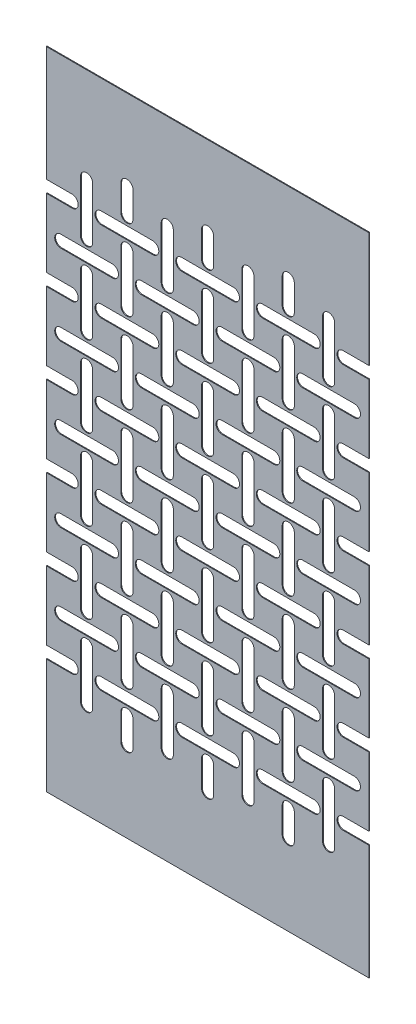
from build123d import *

# Parameters (mm, degrees)
BOSS_EXTRUDE1_DEPTH = 0.2


with BuildPart() as part:
    # Model → Boss-Extrude1 (new body)
    with BuildSketch(Plane.XY):
        with BuildLine():
            Line((0, 31.5), (6.4031, 31.5))
            ThreePointArc((6.4031, 31.5), (7.9031, 30), (6.4031, 28.5))
            Line((6.4031, 28.5), (0, 28.5))
            Line((0, 28.5), (0, 0))
            Line((0, 0), (80, 0))
            Line((80, 0), (80, 28.5))
            Line((80, 28.5), (73.5969, 28.5))
            ThreePointArc((73.5969, 28.5), (72.0969, 30), (73.5969, 31.5))
            Line((73.5969, 31.5), (80, 31.5))
            Line((80, 31.5), (80, 48.5))
            Line((80, 48.5), (73.5969, 48.5))
            ThreePointArc((73.5969, 48.5), (72.0969, 50), (73.5969, 51.5))
            Line((73.5969, 51.5), (80, 51.5))
            Line((80, 51.5), (80, 68.5))
            Line((80, 68.5), (73.5969, 68.5))
            ThreePointArc((73.5969, 68.5), (72.0969, 70), (73.5969, 71.5))
            Line((73.5969, 71.5), (80, 71.5))
            Line((80, 71.5), (80, 88.5))
            Line((80, 88.5), (73.5969, 88.5))
            ThreePointArc((73.5969, 88.5), (72.0969, 90), (73.5969, 91.5))
            Line((73.5969, 91.5), (80, 91.5))
            Line((80, 91.5), (80, 108.5))
            Line((80, 108.5), (73.5969, 108.5))
            ThreePointArc((73.5969, 108.5), (72.0969, 110), (73.5969, 111.5))
            Line((73.5969, 111.5), (80, 111.5))
            Line((80, 111.5), (80, 128.5))
            Line((80, 128.5), (73.5969, 128.5))
            ThreePointArc((73.5969, 128.5), (72.0969, 130), (73.5969, 131.5))
            Line((73.5969, 131.5), (80, 131.5))
            Line((80, 131.5), (80, 160))
            Line((80, 160), (0, 160))
            Line((0, 160), (0, 131.5))
            Line((0, 131.5), (6.4031, 131.5))
            ThreePointArc((6.4031, 131.5), (7.9031, 130), (6.4031, 128.5))
            Line((6.4031, 128.5), (0, 128.5))
            Line((0, 128.5), (0, 111.5))
            Line((0, 111.5), (6.4031, 111.5))
            ThreePointArc((6.4031, 111.5), (7.9031, 110), (6.4031, 108.5))
            Line((6.4031, 108.5), (0, 108.5))
            Line((0, 108.5), (0, 91.5))
            Line((0, 91.5), (6.4031, 91.5))
            ThreePointArc((6.4031, 91.5), (7.9031, 90), (6.4031, 88.5))
            Line((6.4031, 88.5), (0, 88.5))
            Line((0, 88.5), (0, 71.5))
            Line((0, 71.5), (6.4031, 71.5))
            ThreePointArc((6.4031, 71.5), (7.9031, 70), (6.4031, 68.5))
            Line((6.4031, 68.5), (0, 68.5))
            Line((0, 68.5), (0, 51.5))
            Line((0, 51.5), (6.4031, 51.5))
            ThreePointArc((6.4031, 51.5), (7.9031, 50), (6.4031, 48.5))
            Line((6.4031, 48.5), (0, 48.5))
            Line((0, 48.5), (0, 31.5))
        make_face()
        with BuildLine():
            Line((13.5969, 31.5), (26.4031, 31.5))
            ThreePointArc((26.4031, 31.5), (27.9031, 30), (26.4031, 28.5))
            Line((26.4031, 28.5), (13.5969, 28.5))
            ThreePointArc((13.5969, 28.5), (12.0969, 30), (13.5969, 31.5))
        make_face(mode=Mode.SUBTRACT)
        with BuildLine():
            Line((33.5969, 31.5), (46.4031, 31.5))
            ThreePointArc((46.4031, 31.5), (47.9031, 30), (46.4031, 28.5))
            Line((46.4031, 28.5), (33.5969, 28.5))
            ThreePointArc((33.5969, 28.5), (32.0969, 30), (33.5969, 31.5))
        make_face(mode=Mode.SUBTRACT)
        with BuildLine():
            Line((53.5969, 31.5), (66.4031, 31.5))
            ThreePointArc((66.4031, 31.5), (67.9031, 30), (66.4031, 28.5))
            Line((66.4031, 28.5), (53.5969, 28.5))
            ThreePointArc((53.5969, 28.5), (52.0969, 30), (53.5969, 31.5))
        make_face(mode=Mode.SUBTRACT)
        with BuildLine():
            Line((3.5969, 41.5), (16.4031, 41.5))
            ThreePointArc((16.4031, 41.5), (17.9031, 40), (16.4031, 38.5))
            Line((16.4031, 38.5), (3.5969, 38.5))
            ThreePointArc((3.5969, 38.5), (2.0969, 40), (3.5969, 41.5))
        make_face(mode=Mode.SUBTRACT)
        with BuildLine():
            Line((23.5969, 41.5), (36.4031, 41.5))
            ThreePointArc((36.4031, 41.5), (37.9031, 40), (36.4031, 38.5))
            Line((36.4031, 38.5), (23.5969, 38.5))
            ThreePointArc((23.5969, 38.5), (22.0969, 40), (23.5969, 41.5))
        make_face(mode=Mode.SUBTRACT)
        with BuildLine():
            Line((43.5969, 41.5), (56.4031, 41.5))
            ThreePointArc((56.4031, 41.5), (57.9031, 40), (56.4031, 38.5))
            Line((56.4031, 38.5), (43.5969, 38.5))
            ThreePointArc((43.5969, 38.5), (42.0969, 40), (43.5969, 41.5))
        make_face(mode=Mode.SUBTRACT)
        with BuildLine():
            Line((63.5969, 41.5), (76.4031, 41.5))
            ThreePointArc((76.4031, 41.5), (77.9031, 40), (76.4031, 38.5))
            Line((76.4031, 38.5), (63.5969, 38.5))
            ThreePointArc((63.5969, 38.5), (62.0969, 40), (63.5969, 41.5))
        make_face(mode=Mode.SUBTRACT)
        with BuildLine():
            Line((13.5969, 51.5), (26.4031, 51.5))
            ThreePointArc((26.4031, 51.5), (27.9031, 50), (26.4031, 48.5))
            Line((26.4031, 48.5), (13.5969, 48.5))
            ThreePointArc((13.5969, 48.5), (12.0969, 50), (13.5969, 51.5))
        make_face(mode=Mode.SUBTRACT)
        with BuildLine():
            Line((33.5969, 51.5), (46.4031, 51.5))
            ThreePointArc((46.4031, 51.5), (47.9031, 50), (46.4031, 48.5))
            Line((46.4031, 48.5), (33.5969, 48.5))
            ThreePointArc((33.5969, 48.5), (32.0969, 50), (33.5969, 51.5))
        make_face(mode=Mode.SUBTRACT)
        with BuildLine():
            Line((53.5969, 51.5), (66.4031, 51.5))
            ThreePointArc((66.4031, 51.5), (67.9031, 50), (66.4031, 48.5))
            Line((66.4031, 48.5), (53.5969, 48.5))
            ThreePointArc((53.5969, 48.5), (52.0969, 50), (53.5969, 51.5))
        make_face(mode=Mode.SUBTRACT)
        with BuildLine():
            Line((3.5969, 61.5), (16.4031, 61.5))
            ThreePointArc((16.4031, 61.5), (17.9031, 60), (16.4031, 58.5))
            Line((16.4031, 58.5), (3.5969, 58.5))
            ThreePointArc((3.5969, 58.5), (2.0969, 60), (3.5969, 61.5))
        make_face(mode=Mode.SUBTRACT)
        with BuildLine():
            Line((23.5969, 61.5), (36.4031, 61.5))
            ThreePointArc((36.4031, 61.5), (37.9031, 60), (36.4031, 58.5))
            Line((36.4031, 58.5), (23.5969, 58.5))
            ThreePointArc((23.5969, 58.5), (22.0969, 60), (23.5969, 61.5))
        make_face(mode=Mode.SUBTRACT)
        with BuildLine():
            Line((43.5969, 61.5), (56.4031, 61.5))
            ThreePointArc((56.4031, 61.5), (57.9031, 60), (56.4031, 58.5))
            Line((56.4031, 58.5), (43.5969, 58.5))
            ThreePointArc((43.5969, 58.5), (42.0969, 60), (43.5969, 61.5))
        make_face(mode=Mode.SUBTRACT)
        with BuildLine():
            Line((63.5969, 61.5), (76.4031, 61.5))
            ThreePointArc((76.4031, 61.5), (77.9031, 60), (76.4031, 58.5))
            Line((76.4031, 58.5), (63.5969, 58.5))
            ThreePointArc((63.5969, 58.5), (62.0969, 60), (63.5969, 61.5))
        make_face(mode=Mode.SUBTRACT)
        with BuildLine():
            Line((13.5969, 71.5), (26.4031, 71.5))
            ThreePointArc((26.4031, 71.5), (27.9031, 70), (26.4031, 68.5))
            Line((26.4031, 68.5), (13.5969, 68.5))
            ThreePointArc((13.5969, 68.5), (12.0969, 70), (13.5969, 71.5))
        make_face(mode=Mode.SUBTRACT)
        with BuildLine():
            Line((33.5969, 71.5), (46.4031, 71.5))
            ThreePointArc((46.4031, 71.5), (47.9031, 70), (46.4031, 68.5))
            Line((46.4031, 68.5), (33.5969, 68.5))
            ThreePointArc((33.5969, 68.5), (32.0969, 70), (33.5969, 71.5))
        make_face(mode=Mode.SUBTRACT)
        with BuildLine():
            Line((53.5969, 71.5), (66.4031, 71.5))
            ThreePointArc((66.4031, 71.5), (67.9031, 70), (66.4031, 68.5))
            Line((66.4031, 68.5), (53.5969, 68.5))
            ThreePointArc((53.5969, 68.5), (52.0969, 70), (53.5969, 71.5))
        make_face(mode=Mode.SUBTRACT)
        with BuildLine():
            Line((3.5969, 81.5), (16.4031, 81.5))
            ThreePointArc((16.4031, 81.5), (17.9031, 80), (16.4031, 78.5))
            Line((16.4031, 78.5), (3.5969, 78.5))
            ThreePointArc((3.5969, 78.5), (2.0969, 80), (3.5969, 81.5))
        make_face(mode=Mode.SUBTRACT)
        with BuildLine():
            Line((23.5969, 81.5), (36.4031, 81.5))
            ThreePointArc((36.4031, 81.5), (37.9031, 80), (36.4031, 78.5))
            Line((36.4031, 78.5), (23.5969, 78.5))
            ThreePointArc((23.5969, 78.5), (22.0969, 80), (23.5969, 81.5))
        make_face(mode=Mode.SUBTRACT)
        with BuildLine():
            Line((43.5969, 81.5), (56.4031, 81.5))
            ThreePointArc((56.4031, 81.5), (57.9031, 80), (56.4031, 78.5))
            Line((56.4031, 78.5), (43.5969, 78.5))
            ThreePointArc((43.5969, 78.5), (42.0969, 80), (43.5969, 81.5))
        make_face(mode=Mode.SUBTRACT)
        with BuildLine():
            Line((63.5969, 81.5), (76.4031, 81.5))
            ThreePointArc((76.4031, 81.5), (77.9031, 80), (76.4031, 78.5))
            Line((76.4031, 78.5), (63.5969, 78.5))
            ThreePointArc((63.5969, 78.5), (62.0969, 80), (63.5969, 81.5))
        make_face(mode=Mode.SUBTRACT)
        with BuildLine():
            Line((13.5969, 91.5), (26.4031, 91.5))
            ThreePointArc((26.4031, 91.5), (27.9031, 90), (26.4031, 88.5))
            Line((26.4031, 88.5), (13.5969, 88.5))
            ThreePointArc((13.5969, 88.5), (12.0969, 90), (13.5969, 91.5))
        make_face(mode=Mode.SUBTRACT)
        with BuildLine():
            Line((33.5969, 91.5), (46.4031, 91.5))
            ThreePointArc((46.4031, 91.5), (47.9031, 90), (46.4031, 88.5))
            Line((46.4031, 88.5), (33.5969, 88.5))
            ThreePointArc((33.5969, 88.5), (32.0969, 90), (33.5969, 91.5))
        make_face(mode=Mode.SUBTRACT)
        with BuildLine():
            Line((53.5969, 91.5), (66.4031, 91.5))
            ThreePointArc((66.4031, 91.5), (67.9031, 90), (66.4031, 88.5))
            Line((66.4031, 88.5), (53.5969, 88.5))
            ThreePointArc((53.5969, 88.5), (52.0969, 90), (53.5969, 91.5))
        make_face(mode=Mode.SUBTRACT)
        with BuildLine():
            Line((3.5969, 101.5), (16.4031, 101.5))
            ThreePointArc((16.4031, 101.5), (17.9031, 100), (16.4031, 98.5))
            Line((16.4031, 98.5), (3.5969, 98.5))
            ThreePointArc((3.5969, 98.5), (2.0969, 100), (3.5969, 101.5))
        make_face(mode=Mode.SUBTRACT)
        with BuildLine():
            Line((23.5969, 101.5), (36.4031, 101.5))
            ThreePointArc((36.4031, 101.5), (37.9031, 100), (36.4031, 98.5))
            Line((36.4031, 98.5), (23.5969, 98.5))
            ThreePointArc((23.5969, 98.5), (22.0969, 100), (23.5969, 101.5))
        make_face(mode=Mode.SUBTRACT)
        with BuildLine():
            Line((43.5969, 101.5), (56.4031, 101.5))
            ThreePointArc((56.4031, 101.5), (57.9031, 100), (56.4031, 98.5))
            Line((56.4031, 98.5), (43.5969, 98.5))
            ThreePointArc((43.5969, 98.5), (42.0969, 100), (43.5969, 101.5))
        make_face(mode=Mode.SUBTRACT)
        with BuildLine():
            Line((63.5969, 101.5), (76.4031, 101.5))
            ThreePointArc((76.4031, 101.5), (77.9031, 100), (76.4031, 98.5))
            Line((76.4031, 98.5), (63.5969, 98.5))
            ThreePointArc((63.5969, 98.5), (62.0969, 100), (63.5969, 101.5))
        make_face(mode=Mode.SUBTRACT)
        with BuildLine():
            Line((13.5969, 111.5), (26.4031, 111.5))
            ThreePointArc((26.4031, 111.5), (27.9031, 110), (26.4031, 108.5))
            Line((26.4031, 108.5), (13.5969, 108.5))
            ThreePointArc((13.5969, 108.5), (12.0969, 110), (13.5969, 111.5))
        make_face(mode=Mode.SUBTRACT)
        with BuildLine():
            Line((33.5969, 111.5), (46.4031, 111.5))
            ThreePointArc((46.4031, 111.5), (47.9031, 110), (46.4031, 108.5))
            Line((46.4031, 108.5), (33.5969, 108.5))
            ThreePointArc((33.5969, 108.5), (32.0969, 110), (33.5969, 111.5))
        make_face(mode=Mode.SUBTRACT)
        with BuildLine():
            Line((53.5969, 111.5), (66.4031, 111.5))
            ThreePointArc((66.4031, 111.5), (67.9031, 110), (66.4031, 108.5))
            Line((66.4031, 108.5), (53.5969, 108.5))
            ThreePointArc((53.5969, 108.5), (52.0969, 110), (53.5969, 111.5))
        make_face(mode=Mode.SUBTRACT)
        with BuildLine():
            Line((3.5969, 121.5), (16.4031, 121.5))
            ThreePointArc((16.4031, 121.5), (17.9031, 120), (16.4031, 118.5))
            Line((16.4031, 118.5), (3.5969, 118.5))
            ThreePointArc((3.5969, 118.5), (2.0969, 120), (3.5969, 121.5))
        make_face(mode=Mode.SUBTRACT)
        with BuildLine():
            Line((23.5969, 121.5), (36.4031, 121.5))
            ThreePointArc((36.4031, 121.5), (37.9031, 120), (36.4031, 118.5))
            Line((36.4031, 118.5), (23.5969, 118.5))
            ThreePointArc((23.5969, 118.5), (22.0969, 120), (23.5969, 121.5))
        make_face(mode=Mode.SUBTRACT)
        with BuildLine():
            Line((43.5969, 121.5), (56.4031, 121.5))
            ThreePointArc((56.4031, 121.5), (57.9031, 120), (56.4031, 118.5))
            Line((56.4031, 118.5), (43.5969, 118.5))
            ThreePointArc((43.5969, 118.5), (42.0969, 120), (43.5969, 121.5))
        make_face(mode=Mode.SUBTRACT)
        with BuildLine():
            Line((63.5969, 121.5), (76.4031, 121.5))
            ThreePointArc((76.4031, 121.5), (77.9031, 120), (76.4031, 118.5))
            Line((76.4031, 118.5), (63.5969, 118.5))
            ThreePointArc((63.5969, 118.5), (62.0969, 120), (63.5969, 121.5))
        make_face(mode=Mode.SUBTRACT)
        with BuildLine():
            Line((13.5969, 131.5), (26.4031, 131.5))
            ThreePointArc((26.4031, 131.5), (27.9031, 130), (26.4031, 128.5))
            Line((26.4031, 128.5), (13.5969, 128.5))
            ThreePointArc((13.5969, 128.5), (12.0969, 130), (13.5969, 131.5))
        make_face(mode=Mode.SUBTRACT)
        with BuildLine():
            Line((33.5969, 131.5), (46.4031, 131.5))
            ThreePointArc((46.4031, 131.5), (47.9031, 130), (46.4031, 128.5))
            Line((46.4031, 128.5), (33.5969, 128.5))
            ThreePointArc((33.5969, 128.5), (32.0969, 130), (33.5969, 131.5))
        make_face(mode=Mode.SUBTRACT)
        with BuildLine():
            Line((53.5969, 131.5), (66.4031, 131.5))
            ThreePointArc((66.4031, 131.5), (67.9031, 130), (66.4031, 128.5))
            Line((66.4031, 128.5), (53.5969, 128.5))
            ThreePointArc((53.5969, 128.5), (52.0969, 130), (53.5969, 131.5))
        make_face(mode=Mode.SUBTRACT)
        with BuildLine():
            Line((11.5, 23.5969), (11.5, 36.4031))
            ThreePointArc((11.5, 36.4031), (10, 37.9031), (8.5, 36.4031))
            Line((8.5, 36.4031), (8.5, 23.5969))
            ThreePointArc((8.5, 23.5969), (10, 22.0969), (11.5, 23.5969))
        make_face(mode=Mode.SUBTRACT)
        with BuildLine():
            Line((11.5, 43.5969), (11.5, 56.4031))
            ThreePointArc((11.5, 56.4031), (10, 57.9031), (8.5, 56.4031))
            Line((8.5, 56.4031), (8.5, 43.5969))
            ThreePointArc((8.5, 43.5969), (10, 42.0969), (11.5, 43.5969))
        make_face(mode=Mode.SUBTRACT)
        with BuildLine():
            Line((11.5, 63.5969), (11.5, 76.4031))
            ThreePointArc((11.5, 76.4031), (10, 77.9031), (8.5, 76.4031))
            Line((8.5, 76.4031), (8.5, 63.5969))
            ThreePointArc((8.5, 63.5969), (10, 62.0969), (11.5, 63.5969))
        make_face(mode=Mode.SUBTRACT)
        with BuildLine():
            Line((11.5, 83.5969), (11.5, 96.4031))
            ThreePointArc((11.5, 96.4031), (10, 97.9031), (8.5, 96.4031))
            Line((8.5, 96.4031), (8.5, 83.5969))
            ThreePointArc((8.5, 83.5969), (10, 82.0969), (11.5, 83.5969))
        make_face(mode=Mode.SUBTRACT)
        with BuildLine():
            Line((11.5, 103.5969), (11.5, 116.4031))
            ThreePointArc((11.5, 116.4031), (10, 117.9031), (8.5, 116.4031))
            Line((8.5, 116.4031), (8.5, 103.5969))
            ThreePointArc((8.5, 103.5969), (10, 102.0969), (11.5, 103.5969))
        make_face(mode=Mode.SUBTRACT)
        with BuildLine():
            Line((11.5, 123.5969), (11.5, 136.4031))
            ThreePointArc((11.5, 136.4031), (10, 137.9031), (8.5, 136.4031))
            Line((8.5, 136.4031), (8.5, 123.5969))
            ThreePointArc((8.5, 123.5969), (10, 122.0969), (11.5, 123.5969))
        make_face(mode=Mode.SUBTRACT)
        with BuildLine():
            Line((21.5, 20), (21.5, 26.4031))
            ThreePointArc((21.5, 26.4031), (20, 27.9031), (18.5, 26.4031))
            Line((18.5, 26.4031), (18.5, 20))
            ThreePointArc((18.5, 20), (20, 18.5), (21.5, 20))
        make_face(mode=Mode.SUBTRACT)
        with BuildLine():
            Line((21.5, 33.5969), (21.5, 46.4031))
            ThreePointArc((21.5, 46.4031), (20, 47.9031), (18.5, 46.4031))
            Line((18.5, 46.4031), (18.5, 33.5969))
            ThreePointArc((18.5, 33.5969), (20, 32.0969), (21.5, 33.5969))
        make_face(mode=Mode.SUBTRACT)
        with BuildLine():
            Line((21.5, 53.5969), (21.5, 66.4031))
            ThreePointArc((21.5, 66.4031), (20, 67.9031), (18.5, 66.4031))
            Line((18.5, 66.4031), (18.5, 53.5969))
            ThreePointArc((18.5, 53.5969), (20, 52.0969), (21.5, 53.5969))
        make_face(mode=Mode.SUBTRACT)
        with BuildLine():
            Line((21.5, 73.5969), (21.5, 86.4031))
            ThreePointArc((21.5, 86.4031), (20, 87.9031), (18.5, 86.4031))
            Line((18.5, 86.4031), (18.5, 73.5969))
            ThreePointArc((18.5, 73.5969), (20, 72.0969), (21.5, 73.5969))
        make_face(mode=Mode.SUBTRACT)
        with BuildLine():
            Line((21.5, 93.5969), (21.5, 106.4031))
            ThreePointArc((21.5, 106.4031), (20, 107.9031), (18.5, 106.4031))
            Line((18.5, 106.4031), (18.5, 93.5969))
            ThreePointArc((18.5, 93.5969), (20, 92.0969), (21.5, 93.5969))
        make_face(mode=Mode.SUBTRACT)
        with BuildLine():
            Line((21.5, 113.5969), (21.5, 126.4031))
            ThreePointArc((21.5, 126.4031), (20, 127.9031), (18.5, 126.4031))
            Line((18.5, 126.4031), (18.5, 113.5969))
            ThreePointArc((18.5, 113.5969), (20, 112.0969), (21.5, 113.5969))
        make_face(mode=Mode.SUBTRACT)
        with BuildLine():
            Line((21.5, 133.5969), (21.5, 140))
            ThreePointArc((21.5, 140), (20, 141.5), (18.5, 140))
            Line((18.5, 140), (18.5, 133.5969))
            ThreePointArc((18.5, 133.5969), (20, 132.0969), (21.5, 133.5969))
        make_face(mode=Mode.SUBTRACT)
        with BuildLine():
            Line((31.5, 23.5969), (31.5, 36.4031))
            ThreePointArc((31.5, 36.4031), (30, 37.9031), (28.5, 36.4031))
            Line((28.5, 36.4031), (28.5, 23.5969))
            ThreePointArc((28.5, 23.5969), (30, 22.0969), (31.5, 23.5969))
        make_face(mode=Mode.SUBTRACT)
        with BuildLine():
            Line((31.5, 43.5969), (31.5, 56.4031))
            ThreePointArc((31.5, 56.4031), (30, 57.9031), (28.5, 56.4031))
            Line((28.5, 56.4031), (28.5, 43.5969))
            ThreePointArc((28.5, 43.5969), (30, 42.0969), (31.5, 43.5969))
        make_face(mode=Mode.SUBTRACT)
        with BuildLine():
            Line((31.5, 63.5969), (31.5, 76.4031))
            ThreePointArc((31.5, 76.4031), (30, 77.9031), (28.5, 76.4031))
            Line((28.5, 76.4031), (28.5, 63.5969))
            ThreePointArc((28.5, 63.5969), (30, 62.0969), (31.5, 63.5969))
        make_face(mode=Mode.SUBTRACT)
        with BuildLine():
            Line((31.5, 83.5969), (31.5, 96.4031))
            ThreePointArc((31.5, 96.4031), (30, 97.9031), (28.5, 96.4031))
            Line((28.5, 96.4031), (28.5, 83.5969))
            ThreePointArc((28.5, 83.5969), (30, 82.0969), (31.5, 83.5969))
        make_face(mode=Mode.SUBTRACT)
        with BuildLine():
            Line((31.5, 103.5969), (31.5, 116.4031))
            ThreePointArc((31.5, 116.4031), (30, 117.9031), (28.5, 116.4031))
            Line((28.5, 116.4031), (28.5, 103.5969))
            ThreePointArc((28.5, 103.5969), (30, 102.0969), (31.5, 103.5969))
        make_face(mode=Mode.SUBTRACT)
        with BuildLine():
            Line((31.5, 123.5969), (31.5, 136.4031))
            ThreePointArc((31.5, 136.4031), (30, 137.9031), (28.5, 136.4031))
            Line((28.5, 136.4031), (28.5, 123.5969))
            ThreePointArc((28.5, 123.5969), (30, 122.0969), (31.5, 123.5969))
        make_face(mode=Mode.SUBTRACT)
        with BuildLine():
            Line((41.5, 20), (41.5, 26.4031))
            ThreePointArc((41.5, 26.4031), (40, 27.9031), (38.5, 26.4031))
            Line((38.5, 26.4031), (38.5, 20))
            ThreePointArc((38.5, 20), (40, 18.5), (41.5, 20))
        make_face(mode=Mode.SUBTRACT)
        with BuildLine():
            Line((41.5, 33.5969), (41.5, 46.4031))
            ThreePointArc((41.5, 46.4031), (40, 47.9031), (38.5, 46.4031))
            Line((38.5, 46.4031), (38.5, 33.5969))
            ThreePointArc((38.5, 33.5969), (40, 32.0969), (41.5, 33.5969))
        make_face(mode=Mode.SUBTRACT)
        with BuildLine():
            Line((41.5, 53.5969), (41.5, 66.4031))
            ThreePointArc((41.5, 66.4031), (40, 67.9031), (38.5, 66.4031))
            Line((38.5, 66.4031), (38.5, 53.5969))
            ThreePointArc((38.5, 53.5969), (40, 52.0969), (41.5, 53.5969))
        make_face(mode=Mode.SUBTRACT)
        with BuildLine():
            Line((41.5, 73.5969), (41.5, 86.4031))
            ThreePointArc((41.5, 86.4031), (40, 87.9031), (38.5, 86.4031))
            Line((38.5, 86.4031), (38.5, 73.5969))
            ThreePointArc((38.5, 73.5969), (40, 72.0969), (41.5, 73.5969))
        make_face(mode=Mode.SUBTRACT)
        with BuildLine():
            Line((41.5, 93.5969), (41.5, 106.4031))
            ThreePointArc((41.5, 106.4031), (40, 107.9031), (38.5, 106.4031))
            Line((38.5, 106.4031), (38.5, 93.5969))
            ThreePointArc((38.5, 93.5969), (40, 92.0969), (41.5, 93.5969))
        make_face(mode=Mode.SUBTRACT)
        with BuildLine():
            Line((41.5, 113.5969), (41.5, 126.4031))
            ThreePointArc((41.5, 126.4031), (40, 127.9031), (38.5, 126.4031))
            Line((38.5, 126.4031), (38.5, 113.5969))
            ThreePointArc((38.5, 113.5969), (40, 112.0969), (41.5, 113.5969))
        make_face(mode=Mode.SUBTRACT)
        with BuildLine():
            Line((41.5, 133.5969), (41.5, 140))
            ThreePointArc((41.5, 140), (40, 141.5), (38.5, 140))
            Line((38.5, 140), (38.5, 133.5969))
            ThreePointArc((38.5, 133.5969), (40, 132.0969), (41.5, 133.5969))
        make_face(mode=Mode.SUBTRACT)
        with BuildLine():
            Line((51.5, 23.5969), (51.5, 36.4031))
            ThreePointArc((51.5, 36.4031), (50, 37.9031), (48.5, 36.4031))
            Line((48.5, 36.4031), (48.5, 23.5969))
            ThreePointArc((48.5, 23.5969), (50, 22.0969), (51.5, 23.5969))
        make_face(mode=Mode.SUBTRACT)
        with BuildLine():
            Line((51.5, 43.5969), (51.5, 56.4031))
            ThreePointArc((51.5, 56.4031), (50, 57.9031), (48.5, 56.4031))
            Line((48.5, 56.4031), (48.5, 43.5969))
            ThreePointArc((48.5, 43.5969), (50, 42.0969), (51.5, 43.5969))
        make_face(mode=Mode.SUBTRACT)
        with BuildLine():
            Line((51.5, 63.5969), (51.5, 76.4031))
            ThreePointArc((51.5, 76.4031), (50, 77.9031), (48.5, 76.4031))
            Line((48.5, 76.4031), (48.5, 63.5969))
            ThreePointArc((48.5, 63.5969), (50, 62.0969), (51.5, 63.5969))
        make_face(mode=Mode.SUBTRACT)
        with BuildLine():
            Line((51.5, 83.5969), (51.5, 96.4031))
            ThreePointArc((51.5, 96.4031), (50, 97.9031), (48.5, 96.4031))
            Line((48.5, 96.4031), (48.5, 83.5969))
            ThreePointArc((48.5, 83.5969), (50, 82.0969), (51.5, 83.5969))
        make_face(mode=Mode.SUBTRACT)
        with BuildLine():
            Line((51.5, 103.5969), (51.5, 116.4031))
            ThreePointArc((51.5, 116.4031), (50, 117.9031), (48.5, 116.4031))
            Line((48.5, 116.4031), (48.5, 103.5969))
            ThreePointArc((48.5, 103.5969), (50, 102.0969), (51.5, 103.5969))
        make_face(mode=Mode.SUBTRACT)
        with BuildLine():
            Line((51.5, 123.5969), (51.5, 136.4031))
            ThreePointArc((51.5, 136.4031), (50, 137.9031), (48.5, 136.4031))
            Line((48.5, 136.4031), (48.5, 123.5969))
            ThreePointArc((48.5, 123.5969), (50, 122.0969), (51.5, 123.5969))
        make_face(mode=Mode.SUBTRACT)
        with BuildLine():
            Line((61.5, 20), (61.5, 26.4031))
            ThreePointArc((61.5, 26.4031), (60, 27.9031), (58.5, 26.4031))
            Line((58.5, 26.4031), (58.5, 20))
            ThreePointArc((58.5, 20), (60, 18.5), (61.5, 20))
        make_face(mode=Mode.SUBTRACT)
        with BuildLine():
            Line((61.5, 33.5969), (61.5, 46.4031))
            ThreePointArc((61.5, 46.4031), (60, 47.9031), (58.5, 46.4031))
            Line((58.5, 46.4031), (58.5, 33.5969))
            ThreePointArc((58.5, 33.5969), (60, 32.0969), (61.5, 33.5969))
        make_face(mode=Mode.SUBTRACT)
        with BuildLine():
            Line((61.5, 53.5969), (61.5, 66.4031))
            ThreePointArc((61.5, 66.4031), (60, 67.9031), (58.5, 66.4031))
            Line((58.5, 66.4031), (58.5, 53.5969))
            ThreePointArc((58.5, 53.5969), (60, 52.0969), (61.5, 53.5969))
        make_face(mode=Mode.SUBTRACT)
        with BuildLine():
            Line((61.5, 73.5969), (61.5, 86.4031))
            ThreePointArc((61.5, 86.4031), (60, 87.9031), (58.5, 86.4031))
            Line((58.5, 86.4031), (58.5, 73.5969))
            ThreePointArc((58.5, 73.5969), (60, 72.0969), (61.5, 73.5969))
        make_face(mode=Mode.SUBTRACT)
        with BuildLine():
            Line((61.5, 93.5969), (61.5, 106.4031))
            ThreePointArc((61.5, 106.4031), (60, 107.9031), (58.5, 106.4031))
            Line((58.5, 106.4031), (58.5, 93.5969))
            ThreePointArc((58.5, 93.5969), (60, 92.0969), (61.5, 93.5969))
        make_face(mode=Mode.SUBTRACT)
        with BuildLine():
            Line((61.5, 113.5969), (61.5, 126.4031))
            ThreePointArc((61.5, 126.4031), (60, 127.9031), (58.5, 126.4031))
            Line((58.5, 126.4031), (58.5, 113.5969))
            ThreePointArc((58.5, 113.5969), (60, 112.0969), (61.5, 113.5969))
        make_face(mode=Mode.SUBTRACT)
        with BuildLine():
            Line((61.5, 133.5969), (61.5, 140))
            ThreePointArc((61.5, 140), (60, 141.5), (58.5, 140))
            Line((58.5, 140), (58.5, 133.5969))
            ThreePointArc((58.5, 133.5969), (60, 132.0969), (61.5, 133.5969))
        make_face(mode=Mode.SUBTRACT)
        with BuildLine():
            Line((71.5, 23.5969), (71.5, 36.4031))
            ThreePointArc((71.5, 36.4031), (70, 37.9031), (68.5, 36.4031))
            Line((68.5, 36.4031), (68.5, 23.5969))
            ThreePointArc((68.5, 23.5969), (70, 22.0969), (71.5, 23.5969))
        make_face(mode=Mode.SUBTRACT)
        with BuildLine():
            Line((71.5, 43.5969), (71.5, 56.4031))
            ThreePointArc((71.5, 56.4031), (70, 57.9031), (68.5, 56.4031))
            Line((68.5, 56.4031), (68.5, 43.5969))
            ThreePointArc((68.5, 43.5969), (70, 42.0969), (71.5, 43.5969))
        make_face(mode=Mode.SUBTRACT)
        with BuildLine():
            Line((71.5, 63.5969), (71.5, 76.4031))
            ThreePointArc((71.5, 76.4031), (70, 77.9031), (68.5, 76.4031))
            Line((68.5, 76.4031), (68.5, 63.5969))
            ThreePointArc((68.5, 63.5969), (70, 62.0969), (71.5, 63.5969))
        make_face(mode=Mode.SUBTRACT)
        with BuildLine():
            Line((71.5, 83.5969), (71.5, 96.4031))
            ThreePointArc((71.5, 96.4031), (70, 97.9031), (68.5, 96.4031))
            Line((68.5, 96.4031), (68.5, 83.5969))
            ThreePointArc((68.5, 83.5969), (70, 82.0969), (71.5, 83.5969))
        make_face(mode=Mode.SUBTRACT)
        with BuildLine():
            Line((71.5, 103.5969), (71.5, 116.4031))
            ThreePointArc((71.5, 116.4031), (70, 117.9031), (68.5, 116.4031))
            Line((68.5, 116.4031), (68.5, 103.5969))
            ThreePointArc((68.5, 103.5969), (70, 102.0969), (71.5, 103.5969))
        make_face(mode=Mode.SUBTRACT)
        with BuildLine():
            Line((71.5, 123.5969), (71.5, 136.4031))
            ThreePointArc((71.5, 136.4031), (70, 137.9031), (68.5, 136.4031))
            Line((68.5, 136.4031), (68.5, 123.5969))
            ThreePointArc((68.5, 123.5969), (70, 122.0969), (71.5, 123.5969))
        make_face(mode=Mode.SUBTRACT)
    extrude(amount=BOSS_EXTRUDE1_DEPTH)


solid = part.part
